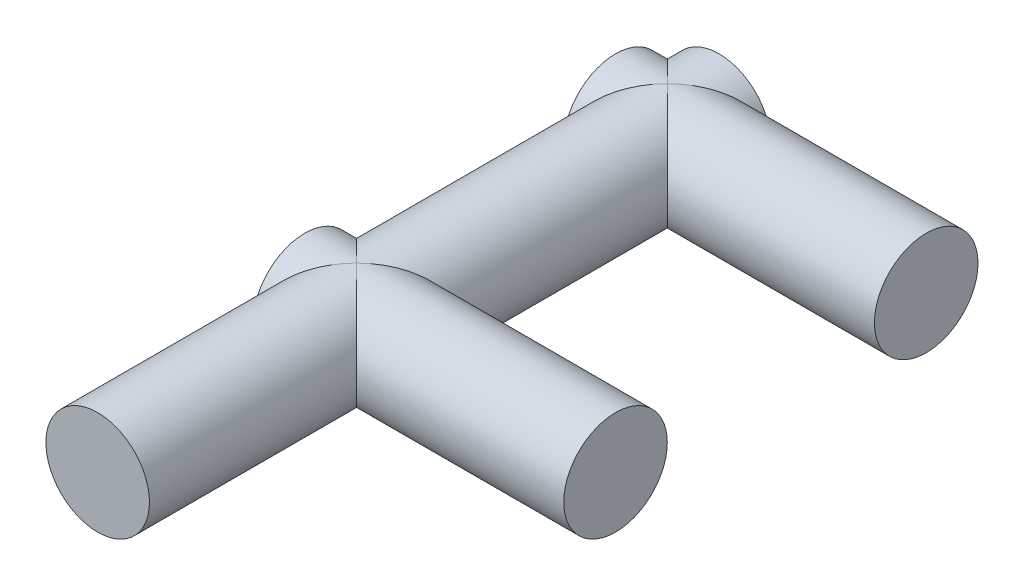
from build123d import *

# Parameters (mm, degrees)
SKETCH3_R                = 0.396875
BOSS_EXTRUDE2_DEPTH      = 2.38125
BOSS_EXTRUDE2_2_DEPTH    = 2.38125
BOSS_EXTRUDE3_DEPTH      = 3.175
BOSS_EXTRUDE3_DEPTH_BACK = 1.5875
SKETCH4_R                = 0.396875


with BuildPart() as part:
    # Sketch3 → Boss-Extrude2 (new body)
    with BuildSketch(Plane(origin=(0, 0, 0), x_dir=(0, 0, -1), z_dir=(1, 0, 0))):
        with Locations((-1.190625, 0)):
            Circle(SKETCH3_R)
    extrude(amount=BOSS_EXTRUDE2_DEPTH)



with BuildPart() as body_2:
    # Sketch3 → Boss-Extrude2 2 (new body)
    with BuildSketch(Plane(origin=(0, 0, 0), x_dir=(0, 0, -1), z_dir=(1, 0, 0))):
        with Locations((1.190625, 0)):
            Circle(SKETCH3_R)
    extrude(amount=BOSS_EXTRUDE2_2_DEPTH)


with BuildPart() as part_1:
    add(part.part)

    add(body_2.part)  # Boss-Extrude3 merges body 2
    # Sketch4 → Boss-Extrude3 (add, two sides: drawn at the far end of the back side and taken through both)
    with BuildSketch(Plane.XY.offset(-BOSS_EXTRUDE3_DEPTH_BACK)):
        with Locations(Location((0.396875, 0, 0), (0, 0, 270))):
            Circle(SKETCH4_R)
    extrude(amount=BOSS_EXTRUDE3_DEPTH + BOSS_EXTRUDE3_DEPTH_BACK)


solid = part_1.part
